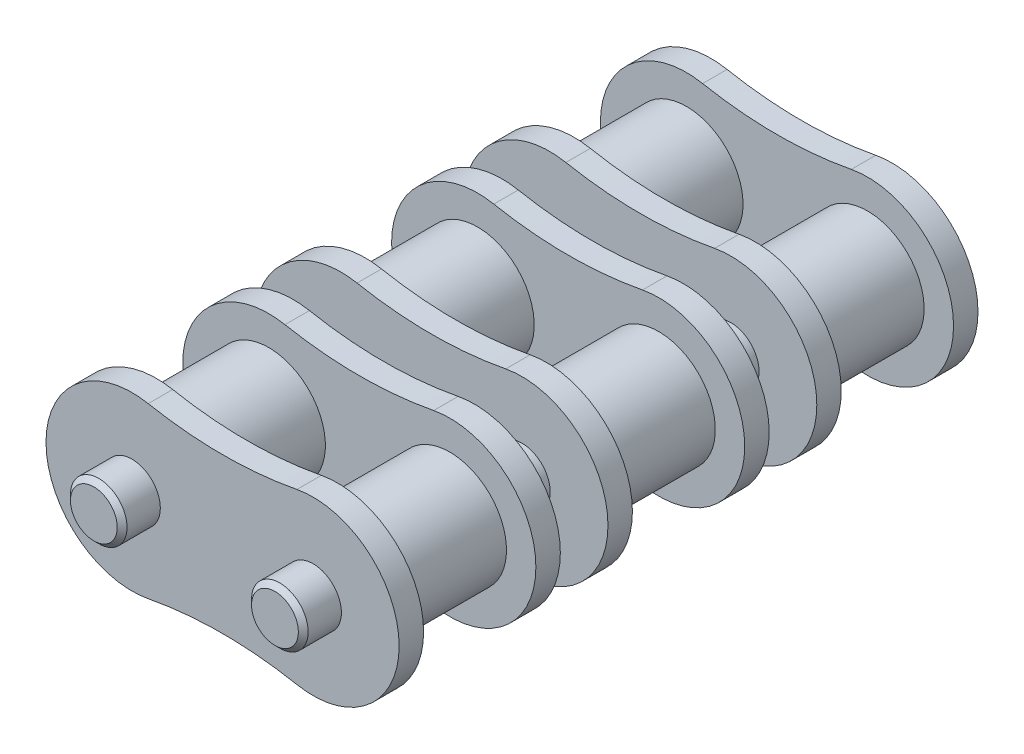
from build123d import *

# Parameters (mm, degrees)
SKETCH_2_R             = 7.94
EXTRUDE_1_DEPTH        = 7.875
EXTRUDE_1_2_DEPTH      = 7.875
EXTRUDE_2_DEPTH        = 3.43
PATTERN_LINEAR_1_COUNT = 3
PATTERN_LINEAR_1_PITCH = 29.29
EXTRUDE_3_DEPTH        = 75.24
EXTRUDE_3_DEPTH_BACK   = 16.66
SKETCH_4_R             = 3.97
CHAMFER_1_SIZE         = 0.686


with BuildPart() as part:
    # 草图2 → 拉伸1 (new, symmetric)
    with BuildSketch(Plane.XY):
        with Locations((12.7, 0)):
            Circle(SKETCH_2_R)
    extrude(amount=EXTRUDE_1_DEPTH, both=True)



with BuildPart() as body_2:
    # 草图2 → Extrude 1 2 (new, symmetric)
    with BuildSketch(Plane.XY):
        with Locations((-12.7, 0)):
            Circle(SKETCH_2_R)
    extrude(amount=EXTRUDE_1_2_DEPTH, both=True)


with BuildPart() as part_1:
    add(part.part)

    add(body_2.part)  # 拉伸2 merges body 2
    # 草图3 → 拉伸2 (add)
    with BuildSketch(Plane.XY.offset(7.875)):
        with BuildLine():
            ThreePointArc((-10.428153415, 11.849174574), (-24.765, 0), (-10.428153415, -11.849174574))
            ThreePointArc((-10.428153415, -11.849174574), (0, -10.8585), (10.428153415, -11.849174574))
            ThreePointArc((10.428153415, -11.849174574), (24.765, 0), (10.428153415, 11.849174574))
            ThreePointArc((10.428153415, 11.849174574), (0, 10.8585), (-10.428153415, 11.849174574))
        make_face()
    extrude_2 = extrude(amount=EXTRUDE_2_DEPTH)

    # 镜向1: 拉伸2 across plane
    add(extrude_2.mirror(Plane.XY))


with BuildPart() as pattern_linear_1_1:
    # 阵列(线性)1: pattern copy
    add(part_1.part.moved(Location(Vector(0, 0, 1) * (1 * PATTERN_LINEAR_1_PITCH))))


with BuildPart() as pattern_linear_1_2:
    # 阵列(线性)1: pattern copy
    add(part_1.part.moved(Location(Vector(0, 0, 1) * (2 * PATTERN_LINEAR_1_PITCH))))


with BuildPart() as part_2:
    add(part_1.part)

    add(pattern_linear_1_1.part)  # 拉伸3 merges 阵列(线性)1_1

    add(pattern_linear_1_2.part)  # 拉伸3 merges 阵列(线性)1_2
    # 草图4 → 拉伸3 (add, two sides: drawn at the far end of the back side and taken through both)
    with BuildSketch(Plane.XY.offset(-EXTRUDE_3_DEPTH_BACK)):
        with Locations(Location((12.7, 0, 0), (0, 0, 180))):
            Circle(SKETCH_4_R)
        with Locations(Location((-12.7, 0, 0), (0, 0, 180))):
            Circle(SKETCH_4_R)
    extrude(amount=EXTRUDE_3_DEPTH + EXTRUDE_3_DEPTH_BACK)

    # 倒角1
    chamfer_1_edges = [part_2.edges().sort_by_distance(p)[0] for p in [
        (16.67, 0, -16.66),
        (16.67, 0, 75.24),
        (-8.73, 0, -16.66),
        (-8.73, 0, 75.24),
    ]]
    chamfer(chamfer_1_edges, length=CHAMFER_1_SIZE)


solid = part_2.part
